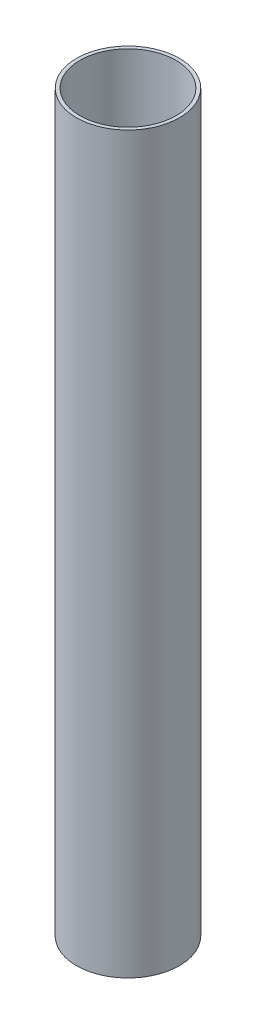
from build123d import *

# Parameters (mm, degrees)
SKETCH1_R           = 49.2125
SKETCH1_R_2         = 45.9359
BOSS_EXTRUDE1_DEPTH = 702.056


with BuildPart() as part:
    # Sketch1 → Boss-Extrude1 (new body)
    with BuildSketch(Plane(origin=(0, 0, 0), x_dir=(1, 0, 0), z_dir=(0, 1, 0))):
        with Locations(Location((0, 0, 0), (0, 0, 270))):
            Circle(SKETCH1_R)
        with Locations(Location((0, 0, 0), (0, 0, 270))):
            Circle(SKETCH1_R_2, mode=Mode.SUBTRACT)
    extrude(amount=BOSS_EXTRUDE1_DEPTH)


solid = part.part
